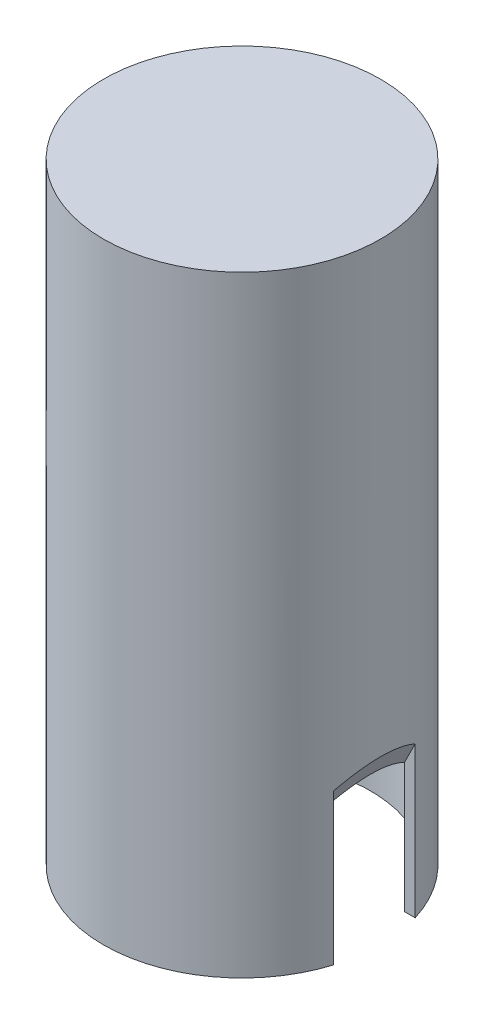
from build123d import *

# Parameters (mm, degrees)
SKETCH3_R               = 68
BOSS_EXTRUDE1_DEPTH     = 300
SHELL1_T                = -5
CUT_EXTRUDE3_DEPTH      = 20
CUT_EXTRUDE3_DEPTH_BACK = 20


with BuildPart() as part:
    # Sketch3 → Boss-Extrude1 (new body)
    with BuildSketch(Plane(origin=(0, 0, 0), x_dir=(1, 0, 0), z_dir=(0, 1, 0))):
        Circle(SKETCH3_R)
    extrude(amount=BOSS_EXTRUDE1_DEPTH)

    # Shell1
    shell1_openings = [part.faces().sort_by_distance(p)[0] for p in [
        (0, 0, 0),
    ]]
    offset(amount=SHELL1_T, openings=shell1_openings, kind=Kind.INTERSECTION)

    # Sketch8 → Cut-Extrude3 (cut, two sides: drawn at the far end of the back side and taken through both)
    with BuildSketch(Plane.XY.offset(-CUT_EXTRUDE3_DEPTH_BACK)):
        Polygon((-68, 0), (-58, 0), (-58, 60), (-68, 80), align=None)
        Polygon((68, 0), (58, 0), (58, 60), (68, 80), align=None)
    extrude(amount=CUT_EXTRUDE3_DEPTH + CUT_EXTRUDE3_DEPTH_BACK, mode=Mode.SUBTRACT)


solid = part.part
